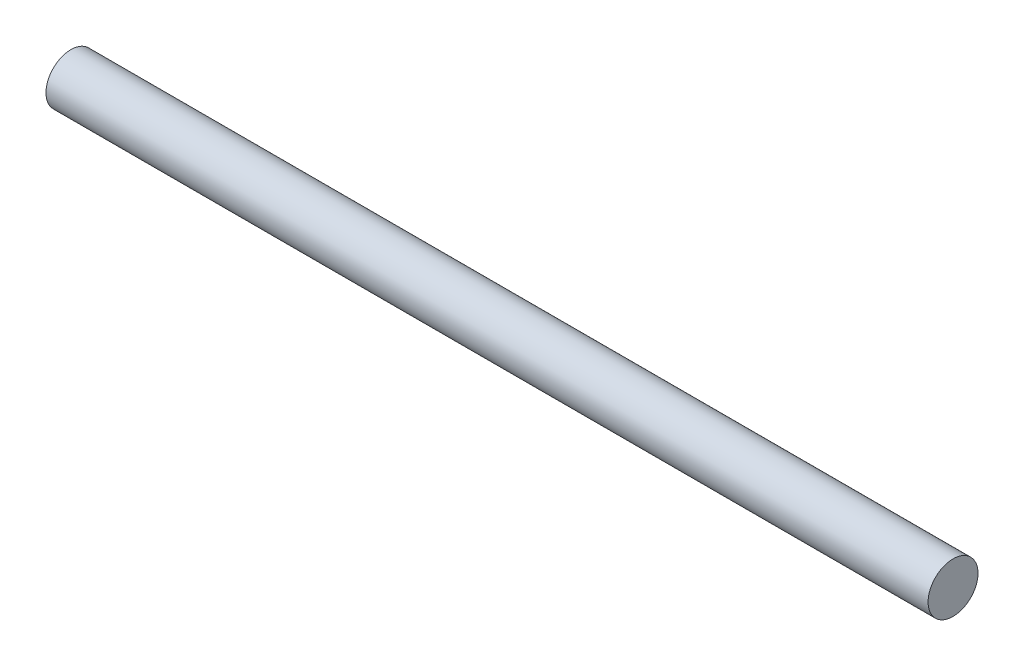
from build123d import *

# Parameters (mm, degrees)
SKETCH_1_R      = 3
EXTRUDE_1_DEPTH = 53


with BuildPart() as part:
    # Эскиз1 → Бобышка-Вытянуть1 (new, symmetric)
    with BuildSketch(Plane(origin=(0, 0, 0), x_dir=(0, 0, -1), z_dir=(1, 0, 0))):
        Circle(SKETCH_1_R)
    extrude(amount=EXTRUDE_1_DEPTH, both=True)


solid = part.part
